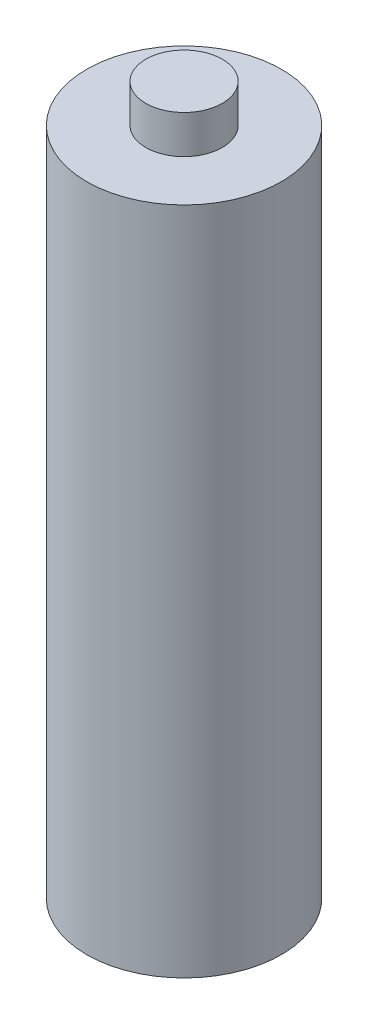
from build123d import *

# Parameters (mm, degrees)
SKETCH_1_R      = 10
EXTRUDE_1_DEPTH = 10
SKETCH_2_R      = 25.46
EXTRUDE_2_DEPTH = 175
SKETCH_3_R      = 10
EXTRUDE_3_DEPTH = 10


with BuildPart() as part:
    # 草图1 → 凸台-拉伸1 (new body)
    with BuildSketch(Plane(origin=(0, 0, 0), x_dir=(1, 0, 0), z_dir=(0, 1, 0))):
        with Locations(Location((0, 0, 0), (0, 0, 270))):
            Circle(SKETCH_1_R)
    extrude(amount=EXTRUDE_1_DEPTH)

    # 草图2 → 凸台-拉伸2 (add)
    with BuildSketch(Plane(origin=(0, 10, 0), x_dir=(1, 0, 0), z_dir=(0, 1, 0))):
        with Locations(Location((0, 0, 0), (0, 0, 270))):
            Circle(SKETCH_2_R)
    extrude(amount=EXTRUDE_2_DEPTH)

    # 草图3 → 凸台-拉伸3 (add)
    with BuildSketch(Plane(origin=(0, 185, 0), x_dir=(1, 0, 0), z_dir=(0, 1, 0))):
        with Locations(Location((0, 0, 0), (0, 0, 270))):
            Circle(SKETCH_3_R)
    extrude(amount=EXTRUDE_3_DEPTH)


solid = part.part
